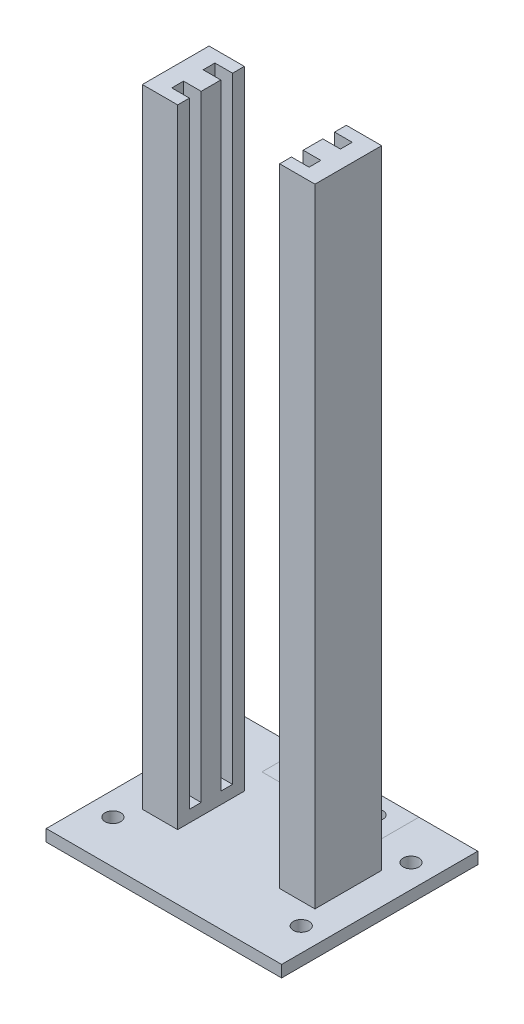
from build123d import *

# Parameters (mm, degrees)
SKETCH1_W           = 60
SKETCH1_H           = 50
BOSS_EXTRUDE1_DEPTH = 3
SKETCH2_W           = 9
SKETCH2_H           = 17
BOSS_EXTRUDE2_DEPTH = 160
SKETCH3_W           = 4.5
SKETCH3_H           = 3
CUT_EXTRUDE1_DEPTH  = 157
CUT_EXTRUDE2_START  = 26
SKETCH4_R           = 1.45
CUT_EXTRUDE2_DEPTH  = 5
CUT_EXTRUDE3_REACH  = 166.697
SKETCH5_R           = 2
SKETCH8_W           = 30
SKETCH8_H           = 10
BOSS_EXTRUDE3_DEPTH = 0.0001
CUT_EXTRUDE4_REACH  = 166.697
SKETCH9_R           = 1.863373193


with BuildPart() as part:
    # Sketch1 → Boss-Extrude1 (new body)
    with BuildSketch(Plane(origin=(0, 0, 0), x_dir=(1, 0, 0), z_dir=(0, 1, 0))):
        Rectangle(SKETCH1_W, SKETCH1_H)
    extrude(amount=BOSS_EXTRUDE1_DEPTH)

    # Sketch2 → Boss-Extrude2 (add)
    with BuildSketch(Plane(origin=(0, 3, 0), x_dir=(1, 0, 0), z_dir=(0, 1, 0))):
        with Locations((17.5, 0)):
            Rectangle(SKETCH2_W, SKETCH2_H)
        with Locations((-17.5, 0)):
            Rectangle(SKETCH2_W, SKETCH2_H)
    extrude(amount=BOSS_EXTRUDE2_DEPTH)

    # Sketch3 → Cut-Extrude1 (cut)
    with BuildSketch(Plane(origin=(0, 163, 0), x_dir=(1, 0, 0), z_dir=(0, 1, 0))):
        with Locations((-15.25, 4)):
            Rectangle(SKETCH3_W, SKETCH3_H)
        with Locations((-15.25, -4)):
            Rectangle(SKETCH3_W, SKETCH3_H)
        with Locations((15.25, -4)):
            Rectangle(SKETCH3_W, SKETCH3_H)
        with Locations((15.25, 4)):
            Rectangle(SKETCH3_W, SKETCH3_H)
    extrude(amount=-CUT_EXTRUDE1_DEPTH, mode=Mode.SUBTRACT)

    # Sketch4 → Cut-Extrude2 (cut)
    with BuildSketch(Plane(origin=(-13, 0, 0), x_dir=(0, 0, -1), z_dir=(1, 0, 0)).offset(CUT_EXTRUDE2_START)):
        with Locations((0, 7)):
            Circle(SKETCH4_R)
        with Locations((0, 160)):
            Circle(SKETCH4_R)
    extrude(amount=CUT_EXTRUDE2_DEPTH, mode=Mode.SUBTRACT)

    # Sketch5 → Cut-Extrude3 (cut, up to next)
    with BuildSketch(Plane(origin=(0, 3, 0), x_dir=(1, 0, 0), z_dir=(0, 1, 0)), mode=Mode.PRIVATE) as cut_extrude3_sk1:
        with Locations(Location((-24, 14, 0), (0, 0, 270))):
            Circle(SKETCH5_R)
    cut_extrude3_tool1 = extrude(cut_extrude3_sk1.sketch, amount=-CUT_EXTRUDE3_REACH, mode=Mode.PRIVATE) & part.part
    # Sketch5 → Cut-Extrude3 (cut, up to next)
    with BuildSketch(Plane(origin=(0, 3, 0), x_dir=(1, 0, 0), z_dir=(0, 1, 0)), mode=Mode.PRIVATE) as cut_extrude3_sk2:
        with Locations(Location((-24, -14, 0), (0, 0, 270))):
            Circle(SKETCH5_R)
    cut_extrude3_tool2 = extrude(cut_extrude3_sk2.sketch, amount=-CUT_EXTRUDE3_REACH, mode=Mode.PRIVATE) & part.part
    # Sketch5 → Cut-Extrude3 (cut, up to next)
    with BuildSketch(Plane(origin=(0, 3, 0), x_dir=(1, 0, 0), z_dir=(0, 1, 0)), mode=Mode.PRIVATE) as cut_extrude3_sk3:
        with Locations(Location((24, -14, 0), (0, 0, 270))):
            Circle(SKETCH5_R)
    cut_extrude3_tool3 = extrude(cut_extrude3_sk3.sketch, amount=-CUT_EXTRUDE3_REACH, mode=Mode.PRIVATE) & part.part
    # Sketch5 → Cut-Extrude3 (cut, up to next)
    with BuildSketch(Plane(origin=(0, 3, 0), x_dir=(1, 0, 0), z_dir=(0, 1, 0)), mode=Mode.PRIVATE) as cut_extrude3_sk4:
        with Locations(Location((24, 14, 0), (0, 0, 270))):
            Circle(SKETCH5_R)
    cut_extrude3_tool4 = extrude(cut_extrude3_sk4.sketch, amount=-CUT_EXTRUDE3_REACH, mode=Mode.PRIVATE) & part.part
    add(cut_extrude3_tool1.solids().sort_by_distance((-24, 3, -14))[0], mode=Mode.SUBTRACT)
    add(cut_extrude3_tool2.solids().sort_by_distance((-24, 3, 14))[0], mode=Mode.SUBTRACT)
    add(cut_extrude3_tool3.solids().sort_by_distance((24, 3, 14))[0], mode=Mode.SUBTRACT)
    add(cut_extrude3_tool4.solids().sort_by_distance((24, 3, -14))[0], mode=Mode.SUBTRACT)

    # Sketch8 → Boss-Extrude3 (add)
    with BuildSketch(Plane(origin=(0, 3, 0), x_dir=(1, 0, 0), z_dir=(0, 1, 0))):
        with Locations((0, 20)):
            Rectangle(SKETCH8_W, SKETCH8_H)
    extrude(amount=BOSS_EXTRUDE3_DEPTH)

    # Sketch9 → Cut-Extrude4 (cut, up to next)
    with BuildSketch(Plane(origin=(0, 3.0001, 0), x_dir=(1, 0, 0), z_dir=(0, 1, 0)), mode=Mode.PRIVATE) as cut_extrude4_sk1:
        with Locations(Location((-9, 20, 0), (0, 0, 270))):
            Circle(SKETCH9_R)
    cut_extrude4_tool1 = extrude(cut_extrude4_sk1.sketch, amount=-CUT_EXTRUDE4_REACH, mode=Mode.PRIVATE) & part.part
    # Sketch9 → Cut-Extrude4 (cut, up to next)
    with BuildSketch(Plane(origin=(0, 3.0001, 0), x_dir=(1, 0, 0), z_dir=(0, 1, 0)), mode=Mode.PRIVATE) as cut_extrude4_sk2:
        with Locations(Location((9, 20, 0), (0, 0, 270))):
            Circle(SKETCH9_R)
    cut_extrude4_tool2 = extrude(cut_extrude4_sk2.sketch, amount=-CUT_EXTRUDE4_REACH, mode=Mode.PRIVATE) & part.part
    add(cut_extrude4_tool1.solids().sort_by_distance((-9, 3.0001, -20))[0], mode=Mode.SUBTRACT)
    add(cut_extrude4_tool2.solids().sort_by_distance((9, 3.0001, -20))[0], mode=Mode.SUBTRACT)


solid = part.part
